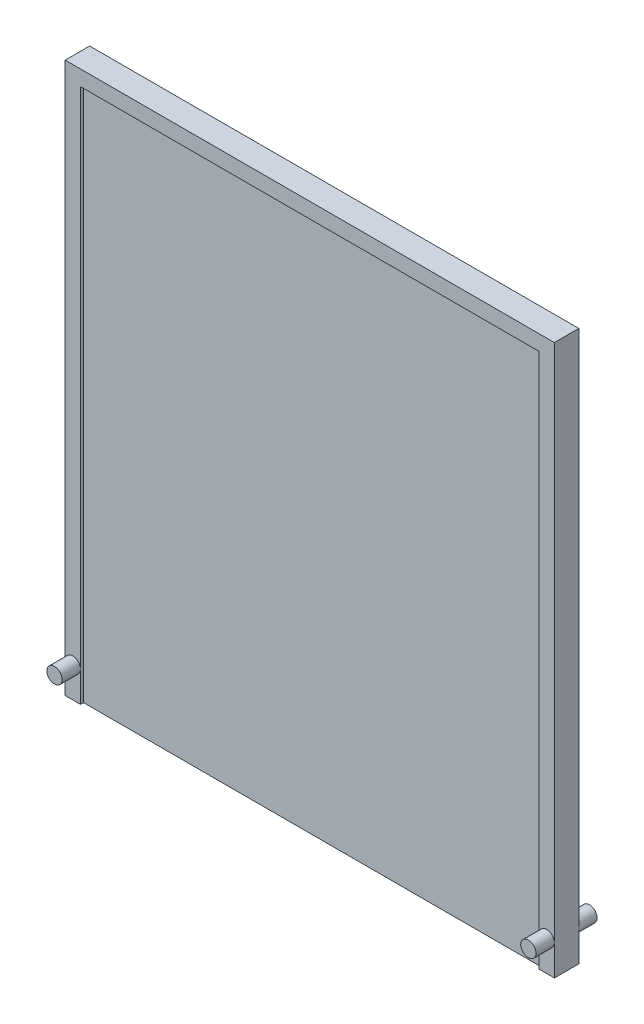
from build123d import *

# Parameters (mm, degrees)
SKETCH_1_W          = 160
SKETCH_1_H          = 180
EXTRUDE_1_DEPTH     = 4
SKETCH_2_W          = 150
SKETCH_2_H          = 175
CUT_EXTRUDE_1_DEPTH = 1
SKETCH_3_R          = 2.5
EXTRUDE_2_DEPTH     = 10


with BuildPart() as part:
    # 草图1 → 凸台-拉伸1 (new, symmetric)
    with BuildSketch(Plane.XY):
        Rectangle(SKETCH_1_W, SKETCH_1_H)
    extrude(amount=EXTRUDE_1_DEPTH, both=True)

    # 草图2 → 切除-拉伸1 (cut)
    with BuildSketch(Plane.XY.offset(4)):
        with Locations((0, -2.5)):
            Rectangle(SKETCH_2_W, SKETCH_2_H)
    extrude(amount=-CUT_EXTRUDE_1_DEPTH, mode=Mode.SUBTRACT)

    # 草图3 → 凸台-拉伸2 (add, symmetric)
    with BuildSketch(Plane.XY):
        with Locations(Location((-77.5, -80, 0), (0, 0, 180))):
            Circle(SKETCH_3_R)
        with Locations(Location((77.5, -80, 0), (0, 0, 180))):
            Circle(SKETCH_3_R)
    extrude(amount=EXTRUDE_2_DEPTH, both=True)


solid = part.part
